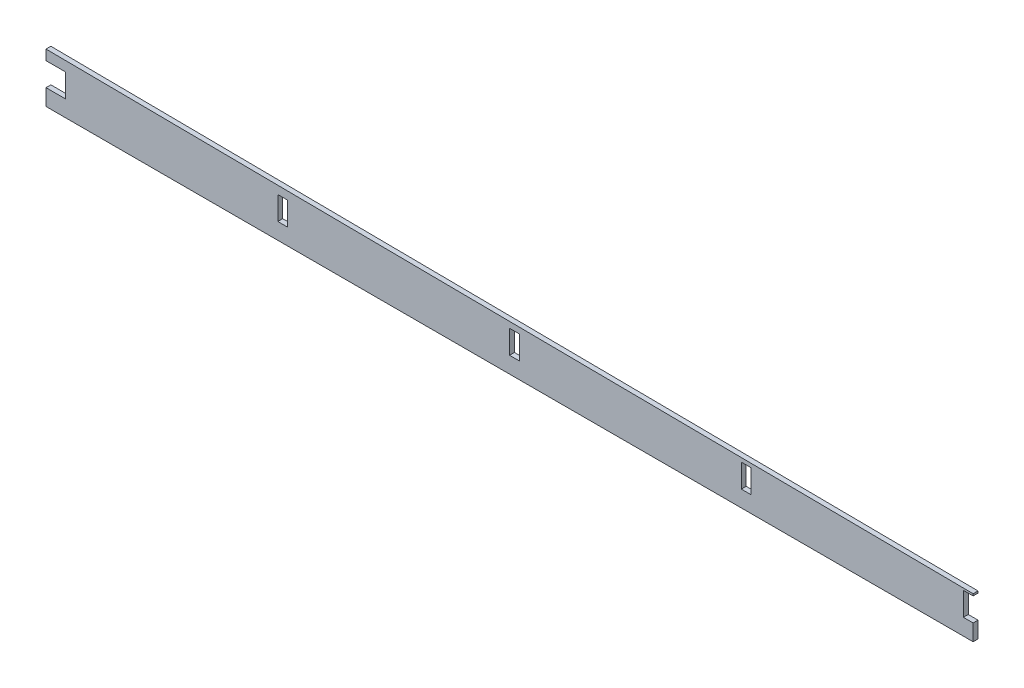
from build123d import *

# Parameters (mm, degrees)
SKETCH1_W           = 3.175
SKETCH1_H           = 7.62
BOSS_EXTRUDE2_DEPTH = 1.5875


with BuildPart() as part:
    # Sketch1 → Boss-Extrude2 (new body)
    with BuildSketch(Plane.XY):
        Polygon((-62.934089734, -79.376648402), (-62.934089734, -74.055362634), (-56.584089734, -74.055362634), (-56.584089734, -66.435362634), (-62.934089734, -66.435362634), (-62.934089734, -63.14950202), (239.325910266, -65.810155514), (239.325910266, -66.435362634), (236.150910266, -66.435362634), (236.150910266, -74.055362634), (239.325910266, -74.055362634), (239.325910266, -79.376648402), align=None)
        with Locations((14.218410266, -70.245362634)):
            Rectangle(SKETCH1_W, SKETCH1_H, mode=Mode.SUBTRACT)
        with Locations((89.783410266, -70.245362634)):
            Rectangle(SKETCH1_W, SKETCH1_H, mode=Mode.SUBTRACT)
        with Locations((165.348410266, -70.245362634)):
            Rectangle(SKETCH1_W, SKETCH1_H, mode=Mode.SUBTRACT)
    extrude(amount=BOSS_EXTRUDE2_DEPTH)


solid = part.part
